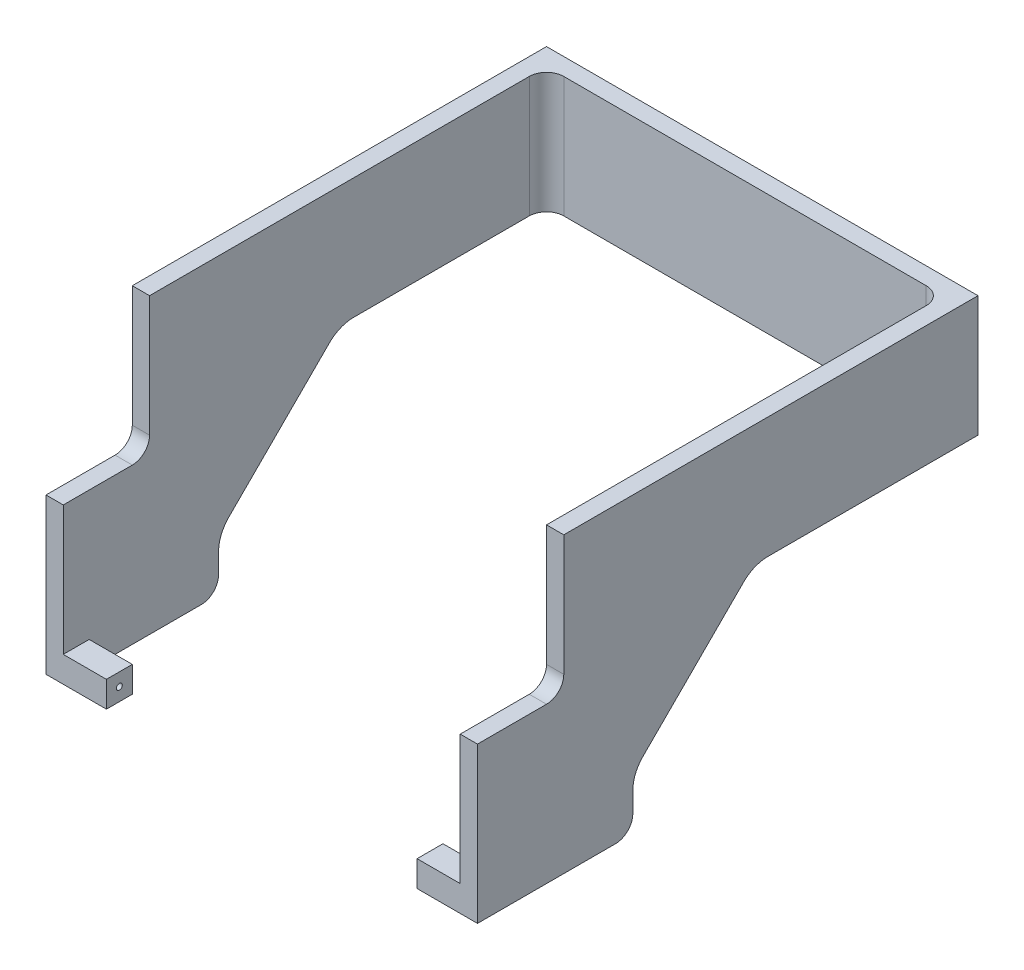
from build123d import *

# Parameters (mm, degrees)
SKETCH_1_W          = 250
SKETCH_1_H          = 170
EXTRUDE_1_DEPTH     = 10
SKETCH_2_W          = 10
SKETCH_2_H          = 170
EXTRUDE_2_DEPTH     = 280
SKETCH_3_W          = 15
SKETCH_3_H          = 15
EXTRUDE_3_DEPTH     = 25
SKETCH_4_W          = 15
SKETCH_4_H          = 15
EXTRUDE_4_DEPTH     = 25
SKETCH_5_R          = 1.7
CUT_EXTRUDE_1_DEPTH = 5
CUT_EXTRUDE_START   = -5
SKETCH_6_R          = 1.7
CUT_EXTRUDE_2_DEPTH = 5
SKETCH_7_W          = 250
SKETCH_7_H          = 100
CUT_EXTRUDE_3_DEPTH = 200
SKETCH_8_W          = 250
SKETCH_8_H          = 80
CUT_EXTRUDE_4_DEPTH = 50
FILLET_1_R          = 10
CHAMFER_2_SIZE      = 70
FILLET_3_R          = 20


with BuildPart() as part:
    # 草图1 → 凸台-拉伸1 (new body)
    with BuildSketch(Plane.XY):
        Rectangle(SKETCH_1_W, SKETCH_1_H)
    extrude(amount=EXTRUDE_1_DEPTH)

    # 草图2 → 凸台-拉伸2 (add)
    with BuildSketch(Plane.XY.offset(10)):
        with Locations((-120, 0)):
            Rectangle(SKETCH_2_W, SKETCH_2_H)
        with Locations((120, 0)):
            Rectangle(SKETCH_2_W, SKETCH_2_H)
    extrude(amount=EXTRUDE_2_DEPTH)

    # 草图3 → 凸台-拉伸3 (add)
    with BuildSketch(Plane(origin=(-115, 0, 0), x_dir=(0, 0, -1), z_dir=(1, 0, 0))):
        with Locations((-282.5, -77.5)):
            Rectangle(SKETCH_3_W, SKETCH_3_H)
    extrude(amount=EXTRUDE_3_DEPTH)

    # 草图4 → 凸台-拉伸4 (add)
    with BuildSketch(Plane.ZY.offset(-115)):
        with Locations((282.5, -77.5)):
            Rectangle(SKETCH_4_W, SKETCH_4_H)
    extrude(amount=EXTRUDE_4_DEPTH)

    # 草图5 → 切除-拉伸1 (cut)
    with BuildSketch(Plane.ZY.offset(-90)):
        with Locations(Location((282.5, -77.5, 0), (0, 0, 270))):
            Circle(SKETCH_5_R)
    extrude(amount=-CUT_EXTRUDE_1_DEPTH, mode=Mode.SUBTRACT)

    # 草图6 → 切除-拉伸2 (cut)
    with BuildSketch(Plane(origin=(-90, 0, 0), x_dir=(0, 0, -1), z_dir=(1, 0, 0)).offset(CUT_EXTRUDE_START)):
        with Locations(Location((-282.5, -77.5, 0), (0, 0, 270))):
            Circle(SKETCH_6_R)
    extrude(amount=CUT_EXTRUDE_2_DEPTH, mode=Mode.SUBTRACT)

    # 草图7 → 切除-拉伸3 (cut)
    with BuildSketch(Plane(origin=(0, 0, 0), x_dir=(-1, 0, 0), z_dir=(0, 0, -1))):
        with Locations((0, -35)):
            Rectangle(SKETCH_7_W, SKETCH_7_H)
    extrude(amount=-CUT_EXTRUDE_3_DEPTH, mode=Mode.SUBTRACT)

    # 草图8 → 切除-拉伸4 (cut)
    with BuildSketch(Plane.XY.offset(290)):
        with Locations((0, 45)):
            Rectangle(SKETCH_8_W, SKETCH_8_H)
    extrude(amount=-CUT_EXTRUDE_4_DEPTH, mode=Mode.SUBTRACT)

    # 圆角1
    fillet_1_edges = [part.edges().sort_by_distance(p)[0] for p in [
        (120, 5, 240),
        (-120, 5, 240),
        (115, 50, 10),
        (-115, 50, 10),
        (120, -85, 200),
        (-120, -85, 200),
    ]]
    fillet(fillet_1_edges, radius=FILLET_1_R)

    # 倒角2
    chamfer_2_edges = [part.edges().sort_by_distance(p)[0] for p in [
        (120, 15, 200),
        (-120, 15, 200),
    ]]
    chamfer(chamfer_2_edges, length=CHAMFER_2_SIZE)

    # 圆角3
    fillet_3_edges = [part.edges().sort_by_distance(p)[0] for p in [
        (120, -55, 200),
        (-120, 15, 130),
        (120, 15, 130),
        (-120, -55, 200),
    ]]
    fillet(fillet_3_edges, radius=FILLET_3_R)


solid = part.part
